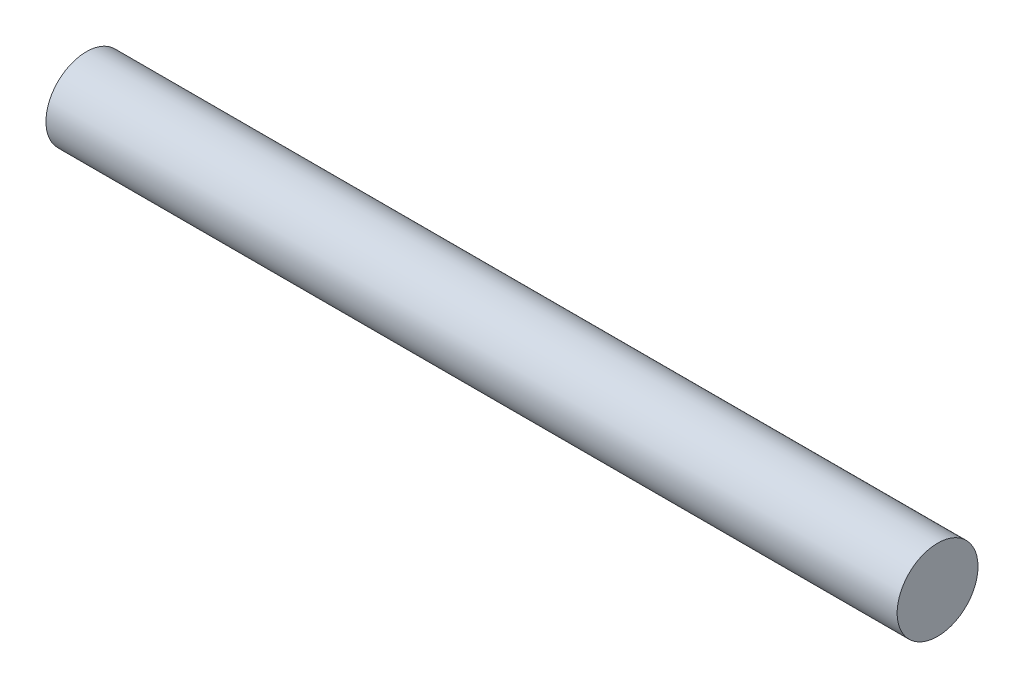
from build123d import *

# Parameters (mm, degrees)
ESBO_O1_R                = 25.4
RESSALTO_EXTRUS_O1_DEPTH = 267.5


with BuildPart() as part:
    # Esboço1 → Ressalto-extrusão1 (new, symmetric)
    with BuildSketch(Plane(origin=(0, 0, 0), x_dir=(0, 0, -1), z_dir=(1, 0, 0))):
        Circle(ESBO_O1_R)
    extrude(amount=RESSALTO_EXTRUS_O1_DEPTH, both=True)


solid = part.part
